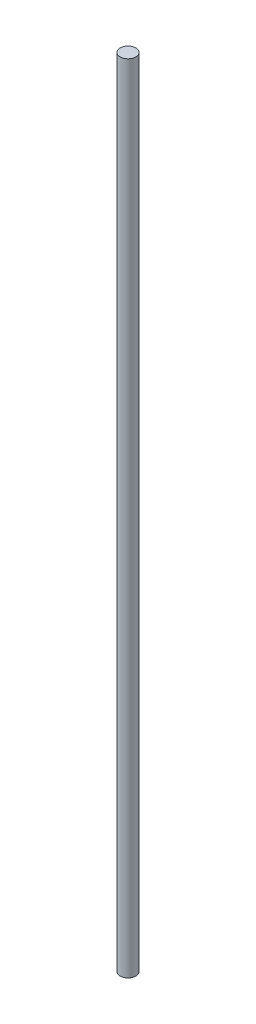
from build123d import *

# Parameters (mm, degrees)
SKETCH_1_R      = 5
EXTRUDE_1_DEPTH = 508


with BuildPart() as part:
    # 草图1 → 凸台-拉伸1 (new body)
    with BuildSketch(Plane(origin=(0, 0, 0), x_dir=(1, 0, 0), z_dir=(0, 1, 0))):
        with Locations(Location((0, 0, 0), (0, 0, 270))):
            Circle(SKETCH_1_R)
    extrude(amount=EXTRUDE_1_DEPTH)


solid = part.part
